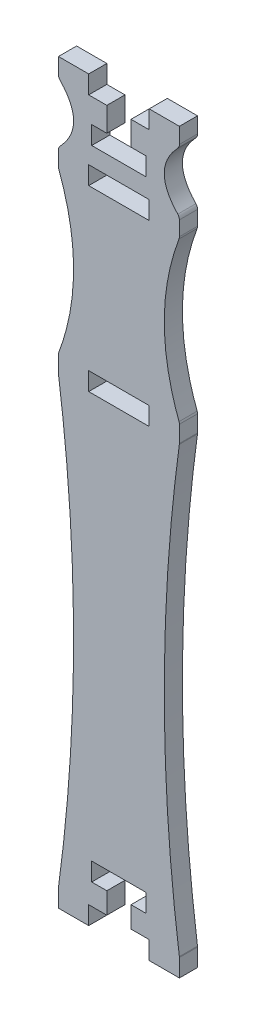
from build123d import *

# Parameters (mm, degrees)
CROQUIS1_W              = 10
CROQUIS1_H              = 3
SALIENTE_EXTRUIR1_DEPTH = 3


with BuildPart() as part:
    # Croquis1 → Saliente-Extruir1 (new body)
    with BuildSketch(Plane.XY):
        with BuildLine():
            Line((-10, 70), (-10, 67))
            Line((-10, 67), (-7, 67))
            Line((-7, 67), (-7, 63))
            Line((-7, 63), (-9.5, 63))
            Line((-9.5, 63), (-9.5, 60))
            Line((-9.5, 60), (-0.5, 60))
            Line((-0.5, 60), (-0.5, 63))
            Line((-0.5, 63), (-3, 63))
            Line((-3, 63), (-3, 67))
            Line((-3, 67), (0, 67))
            Line((0, 67), (0, 70))
            Line((0, 70), (5, 70))
            Line((5, 70), (5, 67.405747627))
            ThreePointArc((5, 67.405747627), (4.929306729, 67.036438809), (4.727221995, 66.719345288))
            add(Edge.make_bspline(
                [(4.727221995, 66.719345288), (3.242407332, 65.146230192), (1.757592668, 62), (3.242407332, 58.853769808), (4.727221995, 57.280654712)],
                knots=[0.028065471, 0.028065471, 0.028065471, 0.028065471, 0.5, 0.971934529, 0.971934529, 0.971934529, 0.971934529], degree=3))
            ThreePointArc((4.727221995, 57.280654712), (4.929306729, 56.963561191), (5, 56.594252373))
            Line((5, 56.594252373), (5, 54.181314171))
            ThreePointArc((5, 54.181314171), (4.9841425, 54.003934523), (4.937072921, 53.832180471))
            add(Edge.make_bspline(
                [(4.937072921, 53.832180471), (3.31235764, 49.471453647), (1.68764236, 40.75), (3.31235764, 32.028546353), (4.937072921, 27.667819529)],
                knots=[0.006332812, 0.006332812, 0.006332812, 0.006332812, 0.5, 0.993667188, 0.993667188, 0.993667188, 0.993667188], degree=3))
            ThreePointArc((4.937072921, 27.667819529), (4.9841425, 27.496065477), (5, 27.318685829))
            Line((5, 27.318685829), (5, 24.567654138))
            ThreePointArc((5, 24.567654138), (4.997723384, 24.500214919), (4.990903903, 24.433082766))
            add(Edge.make_bspline(
                [(4.990903903, -48.933082766), (3.330301301, -36.70538851), (1.669698699, -12.25), (3.330301301, 12.20538851), (4.990903903, 24.433082766)],
                knots=[0.000910439, 0.000910439, 0.000910439, 0.000910439, 0.5, 0.999089561, 0.999089561, 0.999089561, 0.999089561], degree=3))
            ThreePointArc((4.990903903, -48.933082766), (4.997723384, -49.000214919), (5, -49.067654138))
            Line((5, -49.067654138), (5, -51.701381229))
            Line((5, -51.701381229), (5, -52))
            Line((5, -52), (0, -52))
            Line((0, -52), (0, -49))
            Line((0, -49), (-3, -49))
            Line((-3, -49), (-3, -45.5))
            Line((-3, -45.5), (-0.5, -45.5))
            Line((-0.5, -45.5), (-0.5, -42.5))
            Line((-0.5, -42.5), (-9.5, -42.5))
            Line((-9.5, -42.5), (-9.5, -45.5))
            Line((-9.5, -45.5), (-7, -45.5))
            Line((-7, -45.5), (-7, -49))
            Line((-7, -49), (-10, -49))
            Line((-10, -49), (-10, -52))
            Line((-10, -52), (-15, -52))
            Line((-15, -52), (-15, -51.701381229))
            Line((-15, -51.701381229), (-15, -49.067654138))
            ThreePointArc((-15, -49.067654138), (-14.997723384, -49.000214919), (-14.990903903, -48.933082766))
            add(Edge.make_bspline(
                [(-14.990903903, -48.933082766), (-13.330301301, -36.70538851), (-11.669698699, -12.25), (-13.330301301, 12.20538851), (-14.990903903, 24.433082766)],
                knots=[0.000910439, 0.000910439, 0.000910439, 0.000910439, 0.5, 0.999089561, 0.999089561, 0.999089561, 0.999089561], degree=3))
            ThreePointArc((-14.990903903, 24.433082766), (-14.997723384, 24.500214919), (-15, 24.567654138))
            Line((-15, 24.567654138), (-15, 27.318685829))
            ThreePointArc((-15, 27.318685829), (-14.9841425, 27.496065477), (-14.937072921, 27.667819529))
            add(Edge.make_bspline(
                [(-14.937072921, 53.832180471), (-13.31235764, 49.471453647), (-11.68764236, 40.75), (-13.31235764, 32.028546353), (-14.937072921, 27.667819529)],
                knots=[0.006332812, 0.006332812, 0.006332812, 0.006332812, 0.5, 0.993667188, 0.993667188, 0.993667188, 0.993667188], degree=3))
            ThreePointArc((-14.937072921, 53.832180471), (-14.9841425, 54.003934523), (-15, 54.181314171))
            Line((-15, 54.181314171), (-15, 56.594252373))
            ThreePointArc((-15, 56.594252373), (-14.929306729, 56.963561191), (-14.727221995, 57.280654712))
            add(Edge.make_bspline(
                [(-14.727221995, 57.280654712), (-13.242407332, 58.853769808), (-11.757592668, 62), (-13.242407332, 65.146230192), (-14.727221995, 66.719345288)],
                knots=[0.028065471, 0.028065471, 0.028065471, 0.028065471, 0.5, 0.971934529, 0.971934529, 0.971934529, 0.971934529], degree=3))
            ThreePointArc((-14.727221995, 66.719345288), (-14.929306729, 67.036438809), (-15, 67.405747627))
            Line((-15, 67.405747627), (-15, 70))
            Line((-15, 70), (-10, 70))
        make_face()
        with Locations((-5, 26)):
            Rectangle(CROQUIS1_W, CROQUIS1_H, mode=Mode.SUBTRACT)
        with Locations((-5, 55.5)):
            Rectangle(CROQUIS1_W, CROQUIS1_H, mode=Mode.SUBTRACT)
    extrude(amount=SALIENTE_EXTRUIR1_DEPTH)


solid = part.part
